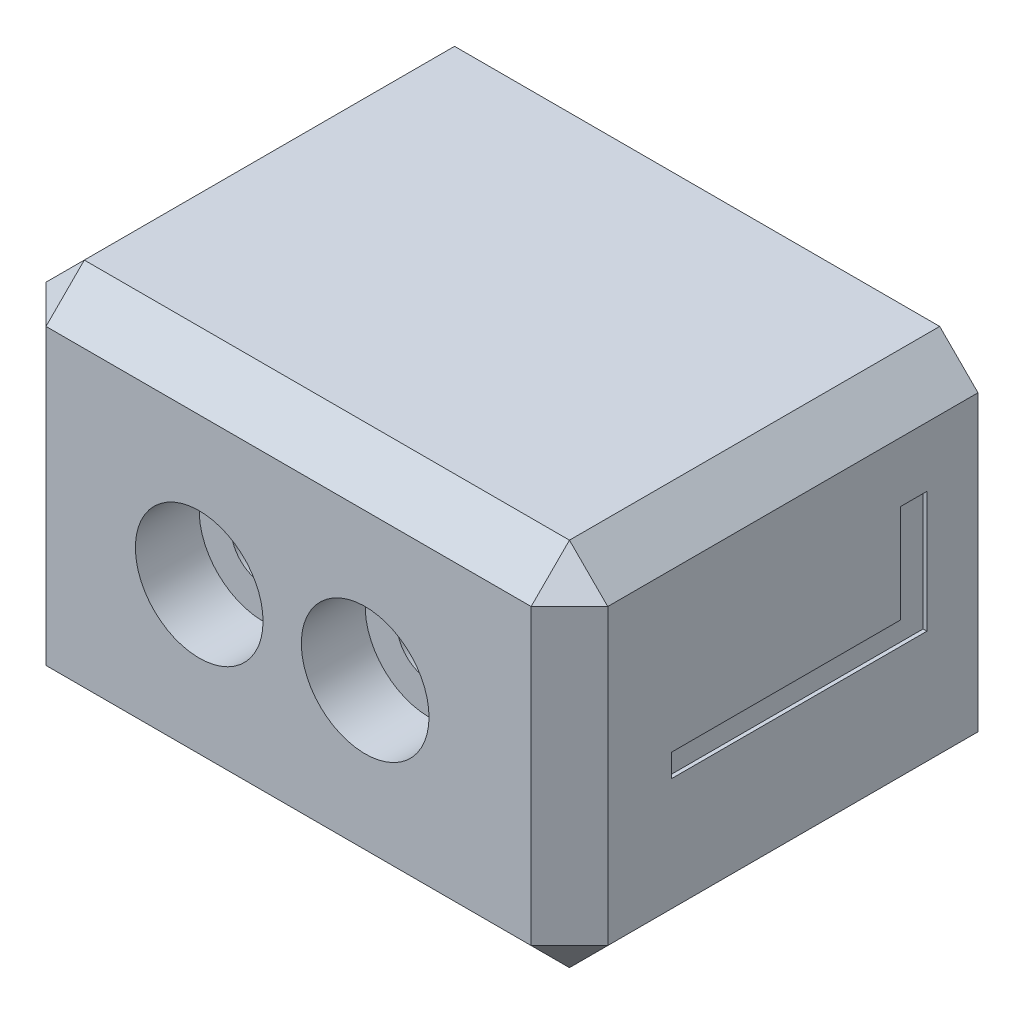
from build123d import *

# Parameters (mm, degrees)
SKETCH1_W               = 44
SKETCH1_H               = 29
SKETCH1_R               = 2.5
BOSS_EXTRUDE1_DEPTH     = 30
CUT_EXTRUDE1_DEPTH      = 25
CUT_EXTRUDE2_DEPTH      = 1
CUT_EXTRUDE2_DEPTH_BACK = 30
SKETCH3_W               = 20
SKETCH3_H               = 7
SKETCH4_R               = 5
CUT_EXTRUDE3_DEPTH      = 3
THICKEN1_T1             = 2
CHAMFER1_SIZE           = 3
CHAMFER2_SIZE           = 4
CUT_EXTRUDE4_DEPTH      = 0.3


with BuildPart() as part:
    # Sketch1 → Boss-Extrude1 (new body)
    with BuildSketch(Plane.XY.offset(794.620141885)):
        with Locations((45.789156386, -208.298939869)):
            Rectangle(SKETCH1_W, SKETCH1_H)
        with Locations((38.789156386, -208.298939869)):
            Circle(SKETCH1_R, mode=Mode.SUBTRACT)
        with Locations((51.789156386, -208.298939869)):
            Circle(SKETCH1_R, mode=Mode.SUBTRACT)
    extrude(amount=BOSS_EXTRUDE1_DEPTH)

    # Sketch2 → Cut-Extrude1 (cut)
    with BuildSketch(Plane.XZ.offset(222.798939869)):
        Polygon((28.289156386, 816.620141885), (48.789156386, 816.620141885), (48.789156386, 806.620141885), (63.289156386, 806.620141885), (63.289156386, 796.620141885), (42.189156386, 796.620141885), (42.189156386, 806.620141885), (28.289156386, 806.620141885), align=None)
    extrude(amount=-CUT_EXTRUDE1_DEPTH, mode=Mode.SUBTRACT)

    # Sketch3 → Cut-Extrude2 (cut, two sides: drawn at the far end of the back side and taken through both)
    with BuildSketch(Plane(origin=(42.189156386, 0, 0), x_dir=(0, 0, -1), z_dir=(1, 0, 0)).offset(-CUT_EXTRUDE2_DEPTH_BACK)):
        with Locations((-806.620141885, -201.298939869)):
            Rectangle(SKETCH3_W, SKETCH3_H)
    extrude(amount=CUT_EXTRUDE2_DEPTH + CUT_EXTRUDE2_DEPTH_BACK, mode=Mode.SUBTRACT)

    # Sketch4 → Cut-Extrude3 (cut)
    with BuildSketch(Plane.XY.offset(824.620141885)):
        with Locations((38.789156386, -208.298939869)):
            Circle(SKETCH4_R)
        with Locations((51.789156386, -208.298939869)):
            Circle(SKETCH4_R)
    extrude(amount=-CUT_EXTRUDE3_DEPTH, mode=Mode.SUBTRACT)

    # Surface-Offset1: a surface, a copy of 1 face of the part
    surface_offset1_1 = part.part.faces().sort_by_distance((45.859348885, -208.298939869, 824.620141885))[0]
    add(Solid.thicken(surface_offset1_1, THICKEN1_T1))

    # Chamfer1
    chamfer1_edges = [part.edges().sort_by_distance(p)[0] for p in [
        (67.789156386, -222.798939869, 810.620141885),
        (23.789156386, -222.798939869, 810.620141885),
        (23.789156386, -193.798939869, 810.620141885),
        (67.789156386, -193.798939869, 810.620141885),
        (67.789156386, -208.298939869, 826.620141885),
        (45.789156386, -193.798939869, 826.620141885),
        (23.789156386, -208.298939869, 826.620141885),
        (45.789156386, -222.798939869, 826.620141885),
    ]]
    chamfer(chamfer1_edges, length=CHAMFER1_SIZE)

    # Chamfer2
    chamfer2_edges = [part.edges().sort_by_distance(p)[0] for p in [
        (42.189156386, -222.798939869, 801.620141885),
        (48.789156386, -222.798939869, 811.620141885),
    ]]
    chamfer(chamfer2_edges, length=CHAMFER2_SIZE)

    # Sketch5 → Cut-Extrude4 (cut)
    with BuildSketch(Plane(origin=(67.789156386, 0, 0), x_dir=(0, 0, -1), z_dir=(1, 0, 0))):
        Polygon((-818.620141885, -210.973121437), (-818.620141885, -209.178249642), (-800.671423936, -209.178249642), (-800.671423936, -201.48594195), (-798.620141885, -201.48594195), (-798.620141885, -210.973121437), align=None)
    extrude(amount=-CUT_EXTRUDE4_DEPTH, mode=Mode.SUBTRACT)


solid = part.part
